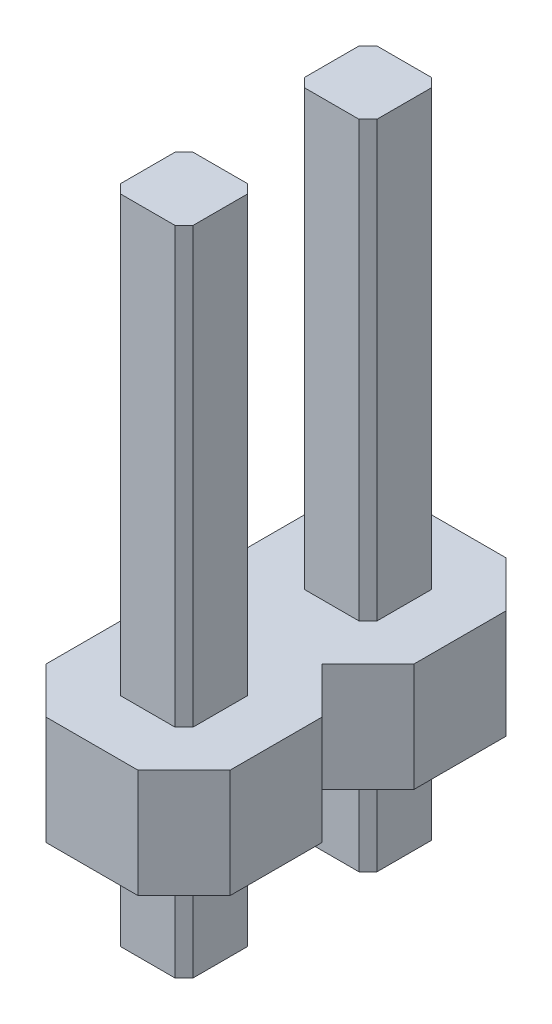
from build123d import *

# Parameters (mm, degrees)
BOSS_EXTRUDE1_DEPTH      = 1.5
BOSS_EXTRUDE2_DEPTH      = 6
BOSS_EXTRUDE2_DEPTH_BACK = 3
CUT_EXTRUDE1_DEPTH       = 13.69206445
CUT_EXTRUDE1_DEPTH_BACK  = 13.69206445
CUT_EXTRUDE2_DEPTH       = 6
CUT_EXTRUDE2_DEPTH_BACK  = 6


with BuildPart() as part:
    # Sketch1 → Boss-Extrude1 (new body)
    with BuildSketch(Plane(origin=(0, 0, 0), x_dir=(1, 0, 0), z_dir=(0, 1, 0))):
        Polygon((-0.635, 10.16), (0.635, 10.16), (1.27, 9.525), (1.27, 8.255), (0.635, 7.62), (1.27, 6.985), (1.27, 5.715), (0.635, 5.08), (1.27, 4.445), (1.27, 3.175), (0.635, 2.54), (1.27, 1.905), (1.27, 0.635), (0.635, 0), (1.27, -0.635), (1.27, -1.905), (0.635, -2.54), (1.27, -3.175), (1.27, -4.445), (0.635, -5.08), (-0.635, -5.08), (-1.27, -4.445), (-1.27, -3.175), (-0.635, -2.54), (-1.27, -1.905), (-1.27, -0.635), (-0.635, 0), (-1.27, 0.635), (-1.27, 1.905), (-0.635, 2.54), (-1.27, 3.175), (-1.27, 4.445), (-0.635, 5.08), (-1.27, 5.715), (-1.27, 6.985), (-0.635, 7.62), (-1.27, 8.255), (-1.27, 9.525), align=None)
    extrude(amount=BOSS_EXTRUDE1_DEPTH)

    # Sketch3 → Boss-Extrude2 (add, two sides: drawn at the far end of the back side and taken through both)
    with BuildSketch(Plane(origin=(0, 1.5, 0), x_dir=(1, 0, 0), z_dir=(0, 1, 0)).offset(-BOSS_EXTRUDE2_DEPTH_BACK)):
        Polygon((0.375, 9.39), (0.5, 9.265), (0.5, 8.515), (0.375, 8.39), (-0.375, 8.39), (-0.5, 8.515), (-0.5, 9.265), (-0.375, 9.39), align=None)
        Polygon((0.375, 6.85), (0.5, 6.725), (0.5, 5.975), (0.375, 5.85), (-0.375, 5.85), (-0.5, 5.975), (-0.5, 6.725), (-0.375, 6.85), align=None)
        Polygon((0.375, 4.31), (0.5, 4.185), (0.5, 3.435), (0.375, 3.31), (-0.375, 3.31), (-0.5, 3.435), (-0.5, 4.185), (-0.375, 4.31), align=None)
        Polygon((0.375, 1.77), (0.5, 1.645), (0.5, 0.895), (0.375, 0.77), (-0.375, 0.77), (-0.5, 0.895), (-0.5, 1.645), (-0.375, 1.77), align=None)
        Polygon((0.375, -0.77), (0.5, -0.895), (0.5, -1.645), (0.375, -1.77), (-0.375, -1.77), (-0.5, -1.645), (-0.5, -0.895), (-0.375, -0.77), align=None)
        Polygon((0.375, -3.31), (0.5, -3.435), (0.5, -4.185), (0.375, -4.31), (-0.375, -4.31), (-0.5, -4.185), (-0.5, -3.435), (-0.375, -3.31), align=None)
    extrude(amount=BOSS_EXTRUDE2_DEPTH + BOSS_EXTRUDE2_DEPTH_BACK)

    # Sketch4 → Cut-Extrude1 (cut, two sides: drawn at the far end of the back side and taken through both)
    with BuildSketch(Plane(origin=(0, 0, 0), x_dir=(1, 0, 0), z_dir=(0, 1, 0)).offset(-CUT_EXTRUDE1_DEPTH_BACK)):
        Polygon((0.635, 2.54), (-0.635, 2.54), (-3.551273802, 2.145414022), (-3.551273802, -5.54901255), (3.518391637, -6.305302341), (3.518391637, 1.323359901), align=None)
    extrude(amount=CUT_EXTRUDE1_DEPTH + CUT_EXTRUDE1_DEPTH_BACK, mode=Mode.SUBTRACT)

    # Sketch5 → Cut-Extrude2 (cut, two sides: drawn at the far end of the back side and taken through both)
    with BuildSketch(Plane(origin=(0, 1.5, 0), x_dir=(1, 0, 0), z_dir=(0, 1, 0)).offset(-CUT_EXTRUDE2_DEPTH_BACK)):
        Polygon((-0.635, 7.62), (0.635, 7.62), (3.304657566, 8.536663962), (1.969828783, 11.132382054), (-2.565180809, 11.132382054), (-2.565180809, 10.824604991), (-2.565180809, 7.895726944), align=None)
    extrude(amount=CUT_EXTRUDE2_DEPTH + CUT_EXTRUDE2_DEPTH_BACK, mode=Mode.SUBTRACT)


solid = part.part
